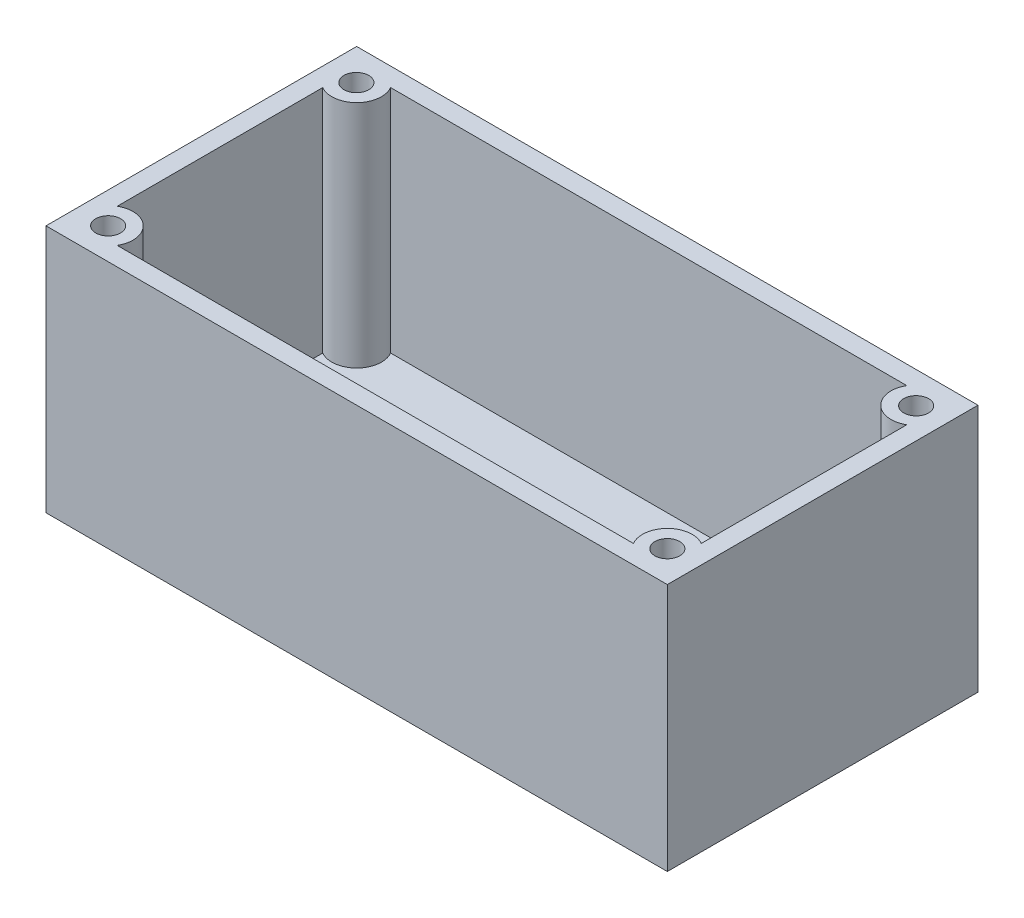
from build123d import *

# Parameters (mm, degrees)
SKETCH_1_W           = 50
SKETCH_1_H           = 25
EXTRUDE_3_DEPTH      = 20
SHELL_1_T            = -1.5
SKETCH_1_3_R         = 2
EXTRUDE_4_DEPTH      = 20
M2X0_4_3_D           = 1.6
M2X0_4_3_DEPTH       = 8
M2X0_4_3_CBORE_D     = 2
M2X0_4_3_CBORE_DEPTH = 4
M2X0_4_3_TIP         = 0.480688495


with BuildPart() as part:
    # 草图1 → 凸台-拉伸3 (new body)
    with BuildSketch(Plane(origin=(0, 0, 0), x_dir=(1, 0, 0), z_dir=(0, 1, 0))):
        with Locations((25, 12.5)):
            Rectangle(SKETCH_1_W, SKETCH_1_H)
    extrude(amount=EXTRUDE_3_DEPTH)

    # 抽壳1
    shell_1_openings = [part.faces().sort_by_distance(p)[0] for p in [
        (25, 20, -12.5),
    ]]
    offset(amount=SHELL_1_T, openings=shell_1_openings, kind=Kind.INTERSECTION)

    # 草图1<3> → 凸台-拉伸4 (add)
    with BuildSketch(Plane(origin=(0, 0, 0), x_dir=(1, 0, 0), z_dir=(0, 1, 0))):
        with Locations((2.5, 22.5)):
            Circle(SKETCH_1_3_R)
        with Locations((47.5, 22.5)):
            Circle(SKETCH_1_3_R)
        with Locations((47.5, 2.5)):
            Circle(SKETCH_1_3_R)
        with Locations((2.5, 2.5)):
            Circle(SKETCH_1_3_R)
    extrude(amount=EXTRUDE_4_DEPTH)

    # M2x0.4 螺纹孔3
    with Locations(Plane(origin=(0, 20, 0), x_dir=(1, 0, 0), z_dir=(0, 1, 0))):
        with Locations((47.553254434, 22.471754376), (47.5, 2.5), (2.503648452, 22.471754376), (2.5, 2.5)):
            CounterBoreHole(M2X0_4_3_D / 2, M2X0_4_3_CBORE_D / 2, M2X0_4_3_CBORE_DEPTH, depth=M2X0_4_3_DEPTH)
            with Locations((0, 0, -(M2X0_4_3_DEPTH + M2X0_4_3_TIP / 2))):  # 118° drill point
                Cone(0, M2X0_4_3_D / 2, M2X0_4_3_TIP, mode=Mode.SUBTRACT)


solid = part.part
